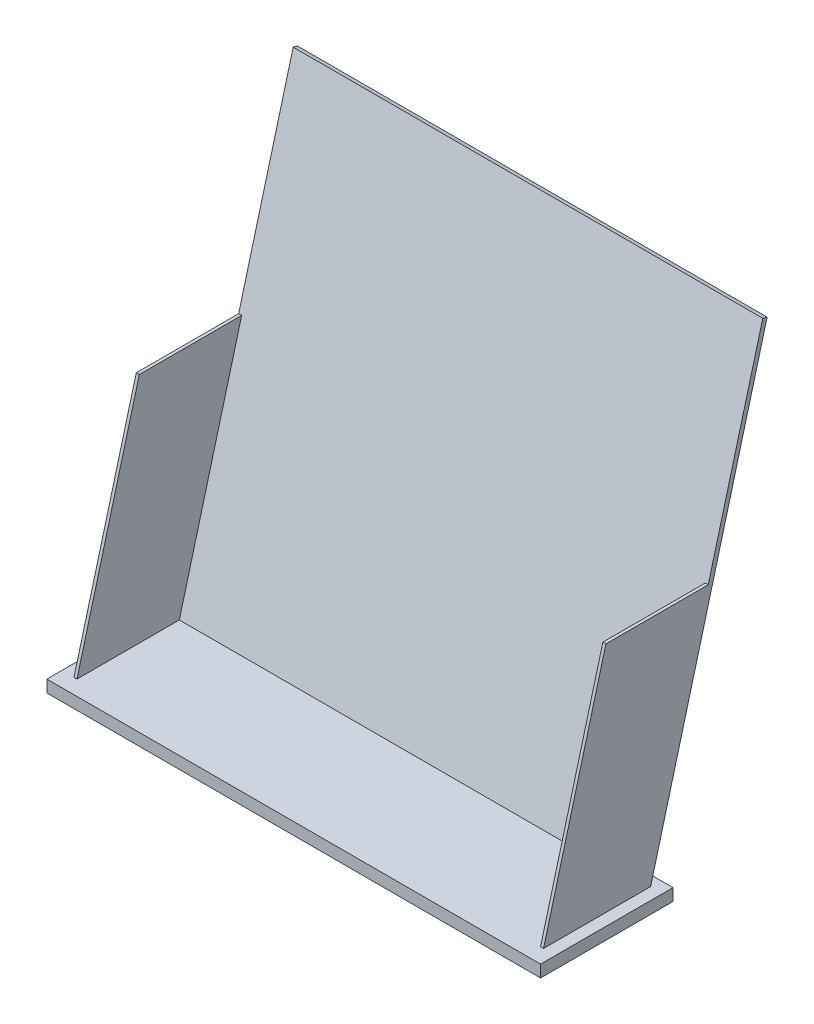
from build123d import *

# Parameters (mm, degrees)
SKETCH1_W           = 82
SKETCH1_H           = 22
BOSS_EXTRUDE1_DEPTH = 2
EXTRUDE_THIN2_DEPTH = 78
BOSS_EXTRUDE2_DEPTH = 0.5
BOSS_EXTRUDE3_DEPTH = 0.5


with BuildPart() as part:
    # Sketch1 → Boss-Extrude1 (new body)
    with BuildSketch(Plane(origin=(0, 0, 0), x_dir=(1, 0, 0), z_dir=(0, 1, 0))):
        Rectangle(SKETCH1_W, SKETCH1_H)
    extrude(amount=BOSS_EXTRUDE1_DEPTH)

    # Sketch4 → Extrude-Thin2 (add)
    with BuildSketch(Plane(origin=(-39, 0, 0), x_dir=(0, 0, -1), z_dir=(1, 0, 0))):
        Polygon((8.5, 2), (27.911428383, 74.444436972), (28.635872752, 74.250322688), (9.22444437, 1.805885716), align=None)
    extrude(amount=EXTRUDE_THIN2_DEPTH)

    # Sketch5 → Boss-Extrude2 (add)
    with BuildSketch(Plane(origin=(39, 0, 0), x_dir=(0, 0, -1), z_dir=(1, 0, 0))):
        Polygon((-8.5, 2), (1.852761804, 40.637033052), (18.852761804, 40.637033052), (8.5, 2), align=None)
    extrude(amount=-BOSS_EXTRUDE2_DEPTH)

    # Sketch6 → Boss-Extrude3 (add)
    with BuildSketch(Plane(origin=(-39, 0, 0), x_dir=(0, 0, -1), z_dir=(1, 0, 0))):
        Polygon((-8.5, 2), (1.852761804, 40.637033052), (18.852761804, 40.637033052), (8.5, 2), align=None)
    extrude(amount=BOSS_EXTRUDE3_DEPTH)


solid = part.part
